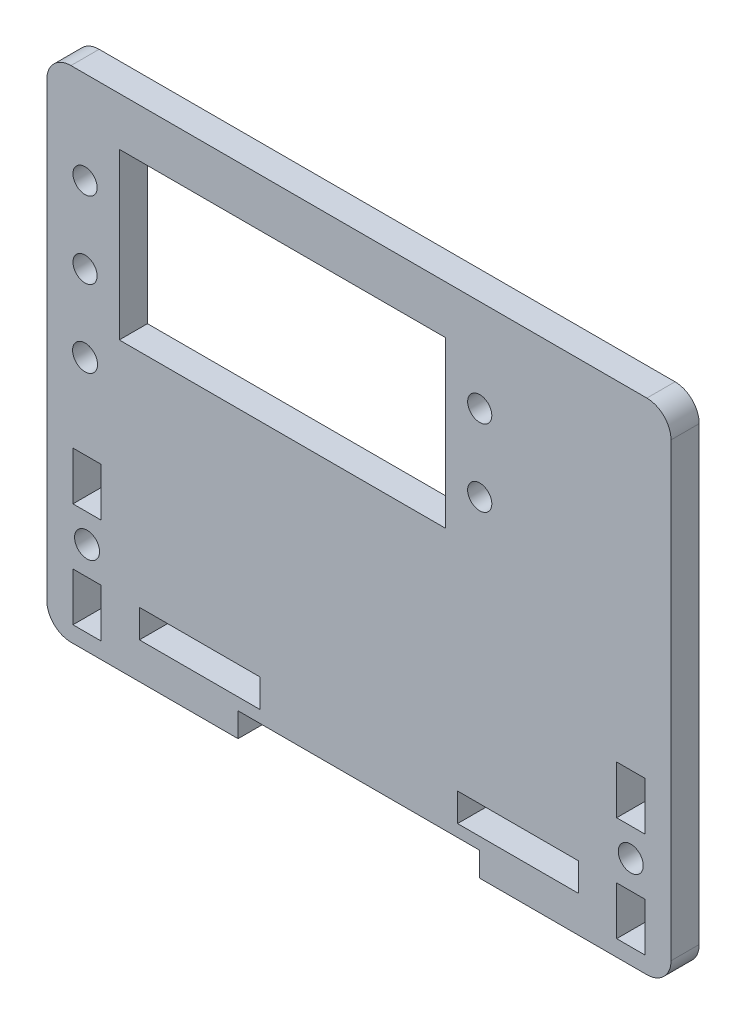
from build123d import *

# Parameters (mm, degrees)
SKETCH1_W               = 40.5
SKETCH1_H               = 20.5
BOSS_EXTRUDE1_DEPTH     = 3.5
SKETCH2_R               = 1.55
SKETCH2_W               = 3.5
SKETCH2_H               = 6
CUT_EXTRUDE1_DEPTH      = 50.747487374
SKETCH3_W               = 15
SKETCH3_H               = 3.5
CUT_EXTRUDE2_DEPTH      = 50.747487374
CUT_EXTRUDE3_DEPTH      = 50.747487374
CUT_EXTRUDE3_DEPTH_BACK = 50.747487374
SKETCH4_R               = 1.5
CUT_EXTRUDE4_REACH      = 51.747
SKETCH5_R               = 1.55
SKETCH6_W               = 30
SKETCH6_H               = 3
CUT_EXTRUDE5_DEPTH      = 10


with BuildPart() as part:
    # Sketch1 → Boss-Extrude1 (new body)
    with BuildSketch(Plane.XY):
        with BuildLine():
            Line((-35.75, -31), (35.75, -31))
            ThreePointArc((35.75, -31), (37.871320344, -30.121320344), (38.75, -28))
            Line((38.75, -28), (38.75, 28))
            ThreePointArc((38.75, 28), (37.871320344, 30.121320344), (35.75, 31))
            Line((35.75, 31), (-35.75, 31))
            ThreePointArc((-35.75, 31), (-37.871320344, 30.121320344), (-38.75, 28))
            Line((-38.75, 28), (-38.75, -28))
            ThreePointArc((-38.75, -28), (-37.871320344, -30.121320344), (-35.75, -31))
        make_face()
        with Locations((-9.5, 14.75)):
            Rectangle(SKETCH1_W, SKETCH1_H, mode=Mode.SUBTRACT)
    extrude(amount=BOSS_EXTRUDE1_DEPTH)

    # Sketch2 → Cut-Extrude1 (cut, through all)
    with BuildSketch(Plane.XY.offset(3.5)):
        with Locations((33.75, -19.5)):
            Circle(SKETCH2_R)
        with Locations(Location((-33.75, -19.5, 0), (0, 0, 180))):
            Circle(SKETCH2_R)
        with Locations((33.75, -13)):
            Rectangle(SKETCH2_W, SKETCH2_H)
        with Locations((33.75, -26)):
            Rectangle(SKETCH2_W, SKETCH2_H)
        with Locations((-33.75, -26)):
            Rectangle(SKETCH2_W, SKETCH2_H)
        with Locations((-33.75, -13)):
            Rectangle(SKETCH2_W, SKETCH2_H)
    extrude(amount=-CUT_EXTRUDE1_DEPTH, mode=Mode.SUBTRACT)

    # Sketch3 → Cut-Extrude2 (cut, through all)
    with BuildSketch(Plane.XY.offset(3.5)):
        with Locations((-19.75, -24.75)):
            Rectangle(SKETCH3_W, SKETCH3_H)
        with Locations((19.75, -24.75)):
            Rectangle(SKETCH3_W, SKETCH3_H)
    extrude(amount=-CUT_EXTRUDE2_DEPTH, mode=Mode.SUBTRACT)

    # Sketch4 → Cut-Extrude3 (cut, two sides: drawn at the far end of the back side and taken through both)
    with BuildSketch(Plane.XY.offset(3.5).offset(-CUT_EXTRUDE3_DEPTH_BACK)):
        with Locations((15, 19.5)):
            Circle(SKETCH4_R)
        with Locations((15, 10)):
            Circle(SKETCH4_R)
        with Locations((-34, 10)):
            Circle(SKETCH4_R)
        with Locations((-34, 19.5)):
            Circle(SKETCH4_R)
    extrude(amount=CUT_EXTRUDE3_DEPTH + CUT_EXTRUDE3_DEPTH_BACK, mode=Mode.SUBTRACT)

    # Sketch5 → Cut-Extrude4 (cut, up to next)
    with BuildSketch(Plane.XY.offset(3.5), mode=Mode.PRIVATE) as cut_extrude4_sk1:
        with Locations((-34, 0.5)):
            Circle(SKETCH5_R)
    cut_extrude4_tool1 = extrude(cut_extrude4_sk1.sketch, amount=-CUT_EXTRUDE4_REACH, mode=Mode.PRIVATE) & part.part
    add(cut_extrude4_tool1.solids().sort_by_distance((-34, 0.5, 3.5))[0], mode=Mode.SUBTRACT)

    # Sketch6 → Cut-Extrude5 (cut)
    with BuildSketch(Plane.XY.offset(3.5)):
        with Locations((0, -29.5)):
            Rectangle(SKETCH6_W, SKETCH6_H)
    extrude(amount=-CUT_EXTRUDE5_DEPTH, mode=Mode.SUBTRACT)


solid = part.part
